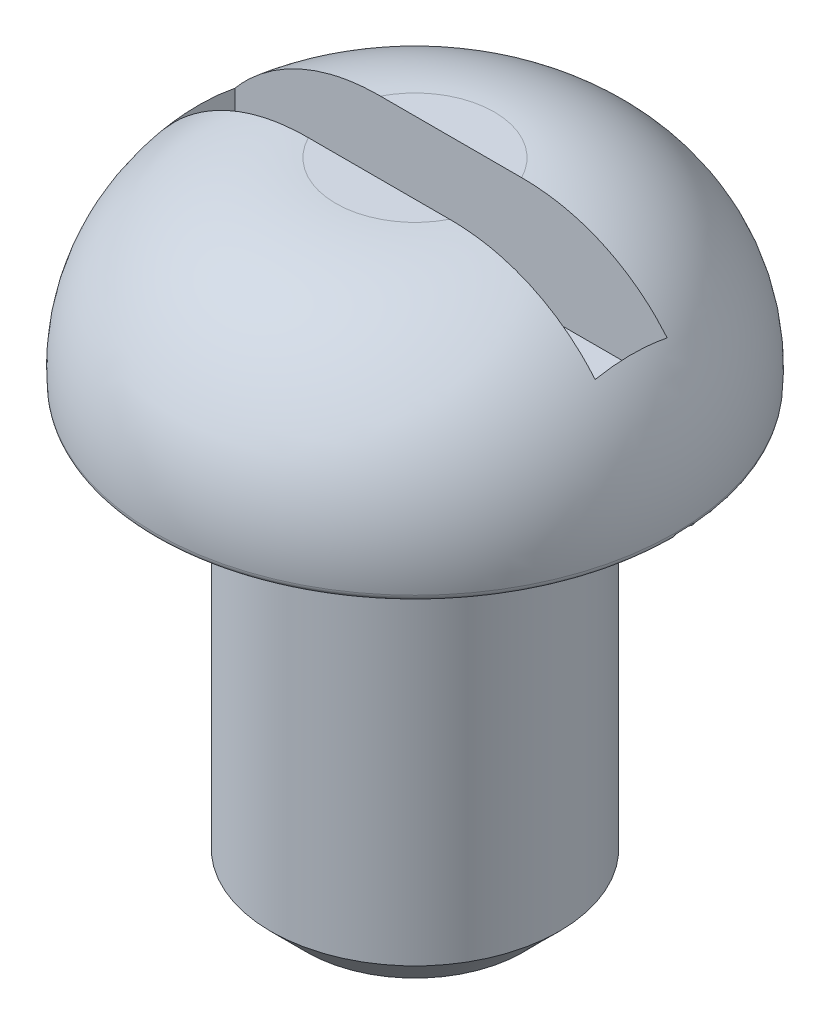
from build123d import *

# Parameters (mm, degrees)
FILLET_1_R          = 0.1
SKETCH_3_W          = 6
SKETCH_3_H          = 1
CUT_EXTRUDE_2_DEPTH = 1.5


with BuildPart() as part:
    # Эскиз1 → Повернуть1 (revolve)
    with BuildSketch(Plane.XY):
        with BuildLine():
            Line((3.6, 6), (2, 6))
            Line((2, 6), (2, 0.5))
            Line((2, 0.5), (1.5, 0))
            Line((1.5, 0), (0, 0))
            Line((0, 0), (0, 8.8))
            Line((0, 8.8), (1.1, 8.8))
            ThreePointArc((1.1, 8.8), (2.976832438, 7.95967182), (3.6, 6))
        make_face()
    revolve(axis=Axis((0, 0, 0), (0, 1, 0)))

    # Скругление1
    fillet_1_edges = [part.edges().sort_by_distance(p)[0] for p in [
        (-3.6, 6, 0),
    ]]
    fillet(fillet_1_edges, radius=FILLET_1_R)

    # Эскиз3 → Вырез-Вытянуть2 (cut)
    with BuildSketch(Plane(origin=(0, 8.8, 0), x_dir=(-1, 0, 0), z_dir=(0, 1, 0))):
        Rectangle(SKETCH_3_W, SKETCH_3_H)
    extrude(amount=-CUT_EXTRUDE_2_DEPTH, mode=Mode.SUBTRACT)


solid = part.part
